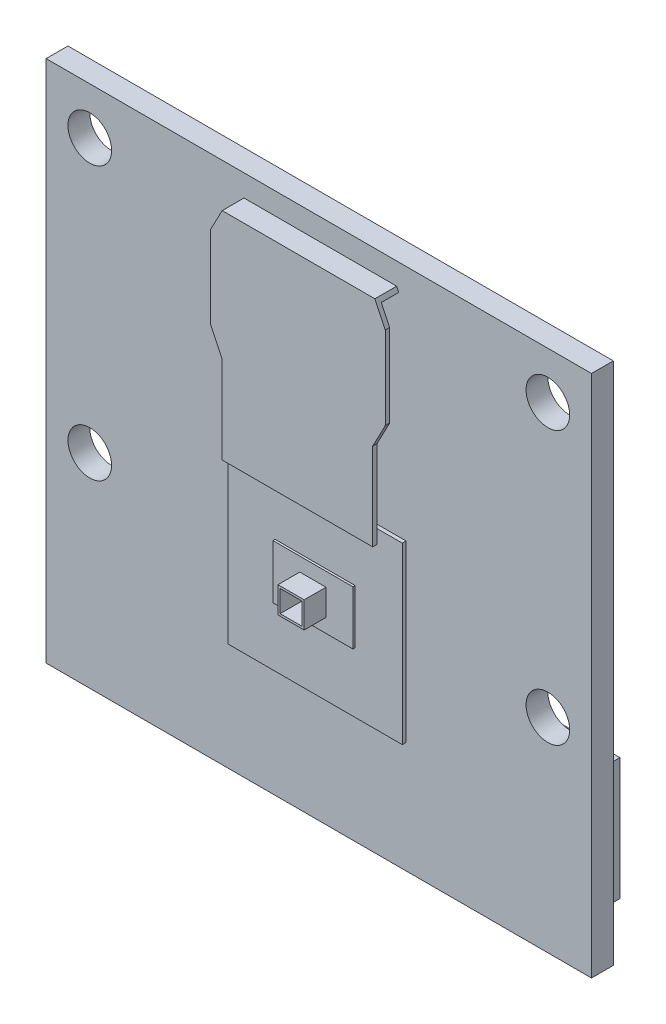
from build123d import *

# Parameters (mm, degrees)
SKETCH1_W                 = 25
SKETCH1_H                 = 24
BOSS_EXTRUDE1_DEPTH       = 1
SKETCH2_R                 = 1
CUT_EXTRUDE1_DEPTH        = 1
SKETCH3_W                 = 8
SKETCH3_H                 = 8
BOSS_EXTRUDE2_DEPTH       = 5.2
SKETCH4_W                 = 8
SKETCH4_H                 = 8
SKETCH4_R                 = 3.75
CUT_EXTRUDE2_DEPTH        = 3.2
SKETCH5_R                 = 3.75
SKETCH5_R_2               = 3
CUT_EXTRUDE3_DEPTH        = 1.2
TOP_RIBBON_DEPTH          = 1
SKETCH7_W                 = 0.8
SKETCH7_H                 = 9.7
CUT_EXTRUDE4_DEPTH        = 9
SKETCH8_W                 = 20
SKETCH8_H                 = 5.6
REAR_RIBBON_DEPTH         = 2.8
CUT_EXTRUDE5_DEPTH        = 10
CUT_EXTRUDE5_DEPTH_BACK   = 1.827942302
SKETCH9_W                 = 8
SKETCH9_H                 = 8
SKETCH10_W                = 3.67
SKETCH10_H                = 2.47
CCD_DEPTH                 = 0.1
SKETCH11_W                = 1.2
SKETCH11_H                = 1.2
SKETCH11_W_2              = 1
SKETCH11_H_2              = 1
TELESCOPE_ALIGNMENT_DEPTH = 1.1


with BuildPart() as part:
    # Sketch1 → Boss-Extrude1 (new body)
    with BuildSketch(Plane.XY):
        Rectangle(SKETCH1_W, SKETCH1_H)
    extrude(amount=BOSS_EXTRUDE1_DEPTH)

    # Sketch2 → Cut-Extrude1 (cut)
    with BuildSketch(Plane.XY.offset(1)):
        with Locations((-10.5, 9.85)):
            Circle(SKETCH2_R)
        with Locations((10.5, 9.85)):
            Circle(SKETCH2_R)
        with Locations((10.5, -2.65)):
            Circle(SKETCH2_R)
        with Locations((-10.5, -2.65)):
            Circle(SKETCH2_R)
    extrude(amount=-CUT_EXTRUDE1_DEPTH, mode=Mode.SUBTRACT)

    # Sketch3 → Boss-Extrude2 (add)
    with BuildSketch(Plane.XY.offset(1)):
        with Locations((0, -2.9)):
            Rectangle(SKETCH3_W, SKETCH3_H)
    extrude(amount=BOSS_EXTRUDE2_DEPTH)

    # Sketch4 → Cut-Extrude2 (cut)
    with BuildSketch(Plane.XY.offset(6.2)):
        with Locations((0, -2.9)):
            Rectangle(SKETCH4_W, SKETCH4_H)
        with Locations((0, -2.9)):
            Circle(SKETCH4_R, mode=Mode.SUBTRACT)
    extrude(amount=-CUT_EXTRUDE2_DEPTH, mode=Mode.SUBTRACT)

    # Sketch5 → Cut-Extrude3 (cut)
    with BuildSketch(Plane.XY.offset(6.2)):
        with Locations((0, -2.9)):
            Circle(SKETCH5_R)
        with Locations((0, -2.9)):
            Circle(SKETCH5_R_2, mode=Mode.SUBTRACT)
    extrude(amount=-CUT_EXTRUDE3_DEPTH, mode=Mode.SUBTRACT)

    # Sketch6 → Top Ribbon (add)
    with BuildSketch(Plane.XY.offset(1)):
        Polygon((-3.430481742, 1.1), (-3.430481742, 5.1), (-3.954291266, 6.2), (-3.954291266, 10), (-3.430481742, 11), (3.569518258, 11), (4.045708734, 10), (4.045708734, 6.2), (3.469518258, 5.1), (3.469518258, 1.1), align=None)
    extrude(amount=TOP_RIBBON_DEPTH)

    # Sketch7 → Cut-Extrude4 (cut)
    with BuildSketch(Plane(origin=(4.045708734, 0, 0), x_dir=(0, 0, -1), z_dir=(1, 0, 0))):
        with Locations((-1.4, 5.95)):
            Rectangle(SKETCH7_W, SKETCH7_H)
    extrude(amount=-CUT_EXTRUDE4_DEPTH, mode=Mode.SUBTRACT)

    # Sketch8 → Rear Ribbon (add)
    with BuildSketch(Plane(origin=(0, 0, 0), x_dir=(-1, 0, 0), z_dir=(0, 0, -1))):
        with Locations((0, -9.2)):
            Rectangle(SKETCH8_W, SKETCH8_H)
    extrude(amount=REAR_RIBBON_DEPTH)

    # Sketch9 → Cut-Extrude5 (cut, two sides: drawn at the far end of the back side and taken through both)
    with BuildSketch(Plane.XY.offset(3).offset(-CUT_EXTRUDE5_DEPTH_BACK)):
        with Locations((0, -2.9)):
            Rectangle(SKETCH9_W, SKETCH9_H)
    extrude(amount=CUT_EXTRUDE5_DEPTH + CUT_EXTRUDE5_DEPTH_BACK, mode=Mode.SUBTRACT)

    # Sketch10 → CCD (add)
    with BuildSketch(Plane.XY.offset(1.172057698)):
        with Locations((0, -2.9)):
            Rectangle(SKETCH10_W, SKETCH10_H)
    extrude(amount=CCD_DEPTH)

    # Sketch11 → Telescope Alignment (add)
    with BuildSketch(Plane.XY.offset(1.172057698)):
        with Locations((0, -2.9)):
            Rectangle(SKETCH11_W, SKETCH11_H)
        with Locations((0, -2.9)):
            Rectangle(SKETCH11_W_2, SKETCH11_H_2, mode=Mode.SUBTRACT)
    extrude(amount=TELESCOPE_ALIGNMENT_DEPTH)


solid = part.part
